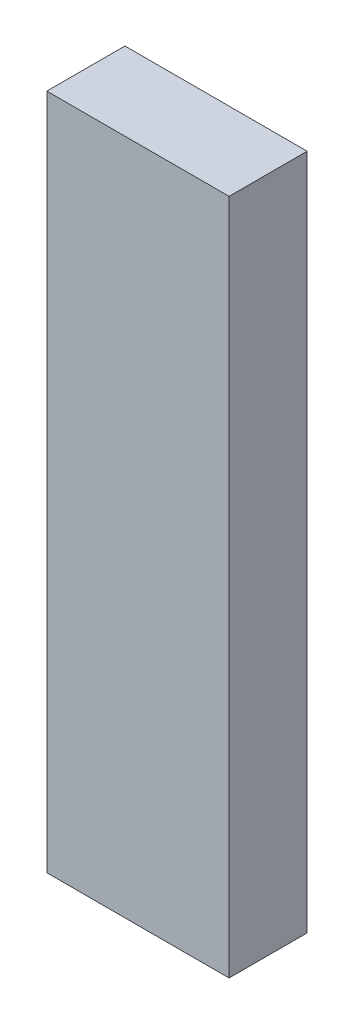
from build123d import *

# Parameters (mm, degrees)
SKETCH1_W           = 88.9
SKETCH1_H           = 38.1
BOSS_EXTRUDE1_DEPTH = 330.2


with BuildPart() as part:
    # Sketch1 → Boss-Extrude1 (new body)
    with BuildSketch(Plane(origin=(0, 0, 0), x_dir=(1, 0, 0), z_dir=(0, 1, 0))):
        with Locations((44.45, 19.05)):
            Rectangle(SKETCH1_W, SKETCH1_H)
    extrude(amount=BOSS_EXTRUDE1_DEPTH)


solid = part.part
